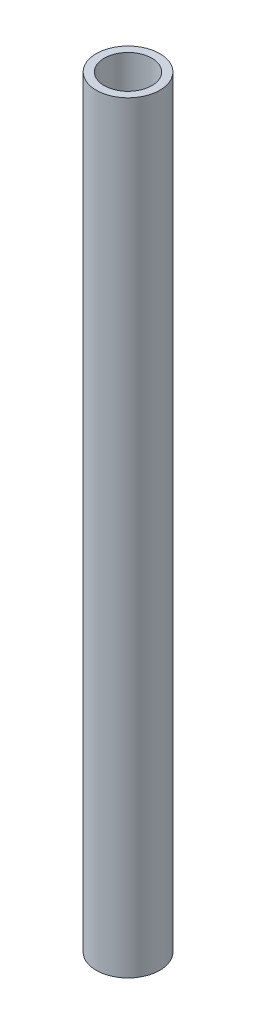
from build123d import *

# Parameters (mm, degrees)
SKETCH1_R           = 25.4
SKETCH1_R_2         = 19.05
BOSS_EXTRUDE1_DEPTH = 609.6


with BuildPart() as part:
    # Sketch1 → Boss-Extrude1 (new body)
    with BuildSketch(Plane(origin=(0, 0, 0), x_dir=(1, 0, 0), z_dir=(0, 1, 0))):
        with Locations(Location((0, 0, 0), (0, 0, 90))):
            Circle(SKETCH1_R)
        with Locations(Location((0, 0, 0), (0, 0, 90))):
            Circle(SKETCH1_R_2, mode=Mode.SUBTRACT)
    extrude(amount=BOSS_EXTRUDE1_DEPTH)


solid = part.part
